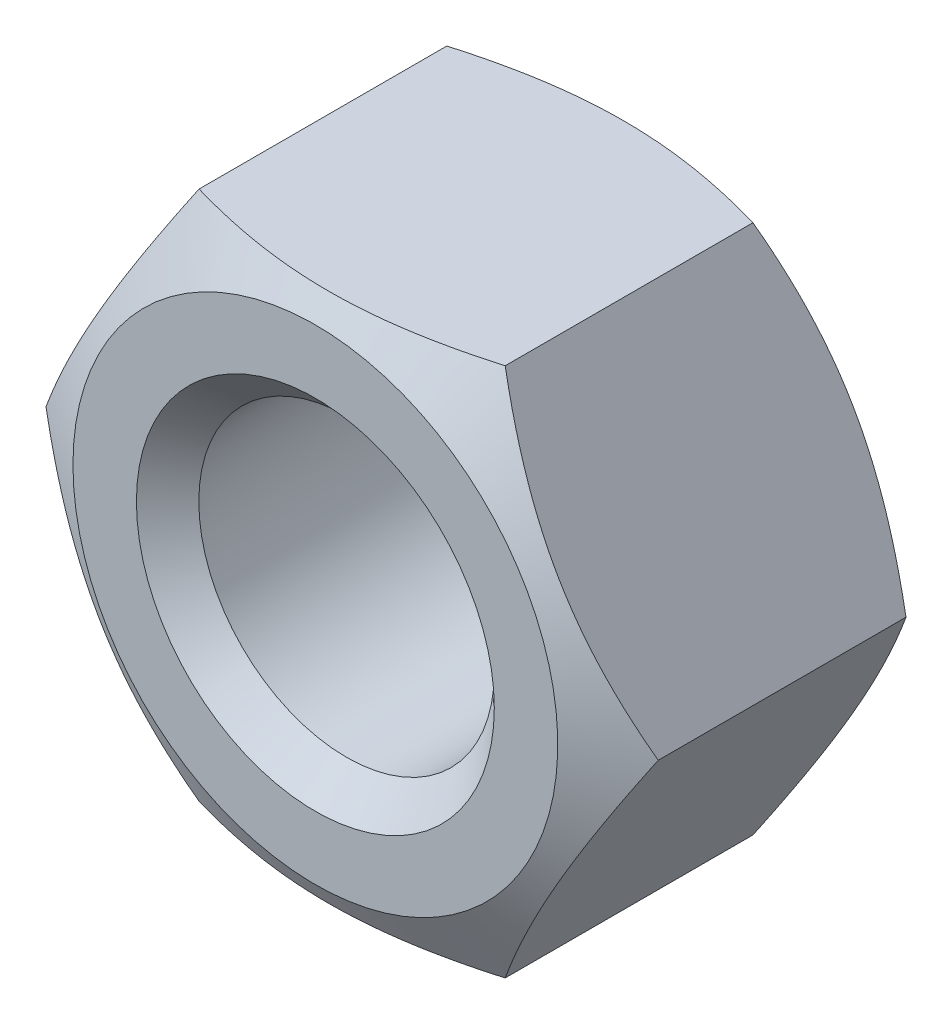
from build123d import *

# Parameters (mm, degrees)
SKETCH1_R        = 4.4585
BASENUT_DEPTH    = 9.3
ENDCHAMFER2_SIZE = 0.9415


with BuildPart() as part:
    # Sketch1 → BaseNut (new body)
    with BuildSketch(Plane.XY):
        Polygon((4.618802154, -8), (9.237604307, 0), (4.618802154, 8), (-4.618802154, 8), (-9.237604307, 0), (-4.618802154, -8), align=None)
        Circle(SKETCH1_R, mode=Mode.SUBTRACT)
    extrude(amount=-BASENUT_DEPTH)

    # Sketch2 → Chamfer1 (revolve, cut)
    with BuildSketch(Plane(origin=(15.04811501, 0, -16.706149795), x_dir=(0, 0, -1), z_dir=(0, 1, 0))):
        Polygon((-8.120680975, 24.285719317), (-7.406149795, 23.04811501), (-7.406149795, 24.285719317), align=None)
    revolve(axis=Axis((0, 0, 7.016501752), (0, 0, -1)), mode=Mode.SUBTRACT)

    # Sketch6 → EndChamfer1 (revolve, cut)
    with BuildSketch(Plane(origin=(-9.197458863, 0, -10.252541137), x_dir=(0, 0, 1), z_dir=(0, 1, 0))):
        Polygon((0.952541137, 13.655958863), (0.952541137, 14.597458863), (1.496116416, 13.655958863), align=None)
    revolve(axis=Axis((0, 0, 13.104863586), (0, 0, -1)), mode=Mode.SUBTRACT)

    # Sketch5 → Chamfer2 (revolve, cut)
    with BuildSketch(Plane(origin=(-14.793032735, 0, -16.96123207), x_dir=(0, 0, 1), z_dir=(0, 1, 0)), mode=Mode.PRIVATE) as chamfer2_sk:
        Polygon((16.96123207, 22.108032735), (16.96123207, 24.030637042), (15.851215956, 24.030637042), align=None)
    revolve(chamfer2_sk.sketch.rotate(Axis((0, 0, -39.536013381), (0, 0, 1)), 180), axis=Axis((0, 0, -39.536013381), (0, 0, 1)), mode=Mode.SUBTRACT)

    # EndChamfer2
    endchamfer2_edges = [part.edges().sort_by_distance(p)[0] for p in [
        (-4.4585, 0, 0),
    ]]
    chamfer(endchamfer2_edges, length=ENDCHAMFER2_SIZE)


solid = part.part
